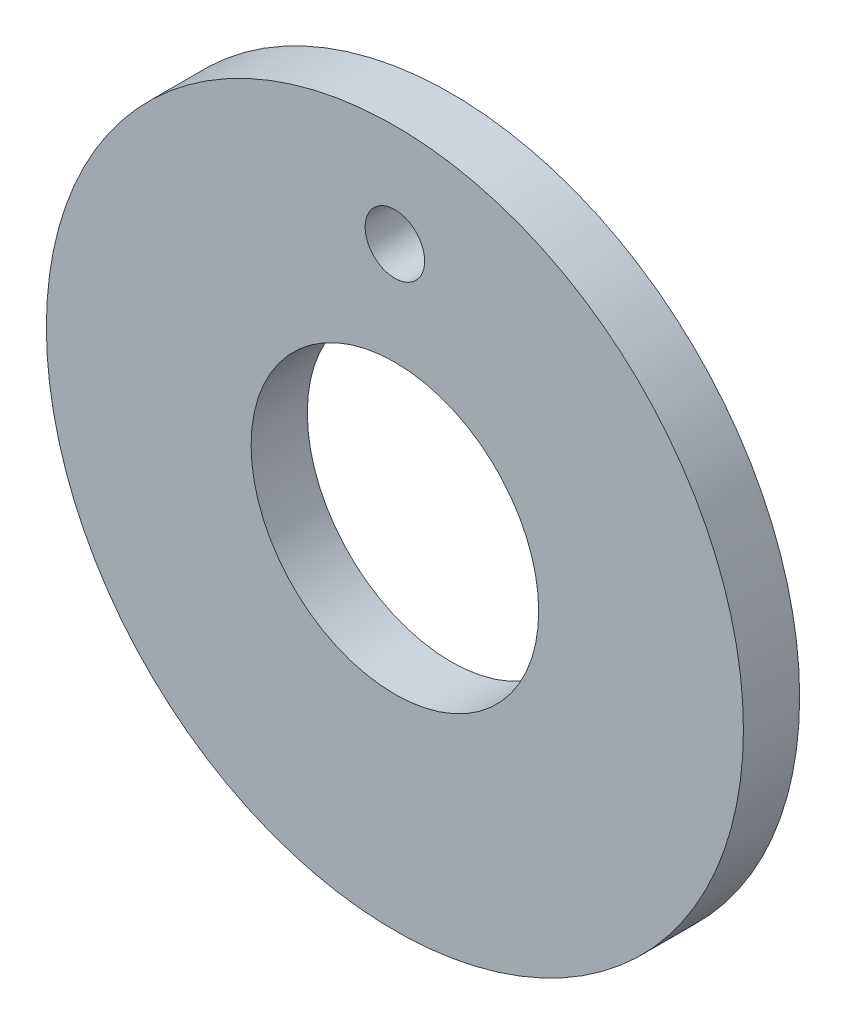
from build123d import *

# Parameters (mm, degrees)
SKETCH1_R           = 37.2
SKETCH1_R_2         = 15.35
BOSS_EXTRUDE1_DEPTH = 6
SKETCH2_R           = 3.175
CUT_EXTRUDE1_DEPTH  = 6


with BuildPart() as part:
    # Sketch1 → Boss-Extrude1 (new body)
    with BuildSketch(Plane.XY):
        Circle(SKETCH1_R)
        Circle(SKETCH1_R_2, mode=Mode.SUBTRACT)
    extrude(amount=BOSS_EXTRUDE1_DEPTH)

    # Sketch2 → Cut-Extrude1 (cut)
    with BuildSketch(Plane.XY.offset(6)):
        with Locations((0, 26.275)):
            Circle(SKETCH2_R)
    extrude(amount=-CUT_EXTRUDE1_DEPTH, mode=Mode.SUBTRACT)


solid = part.part
